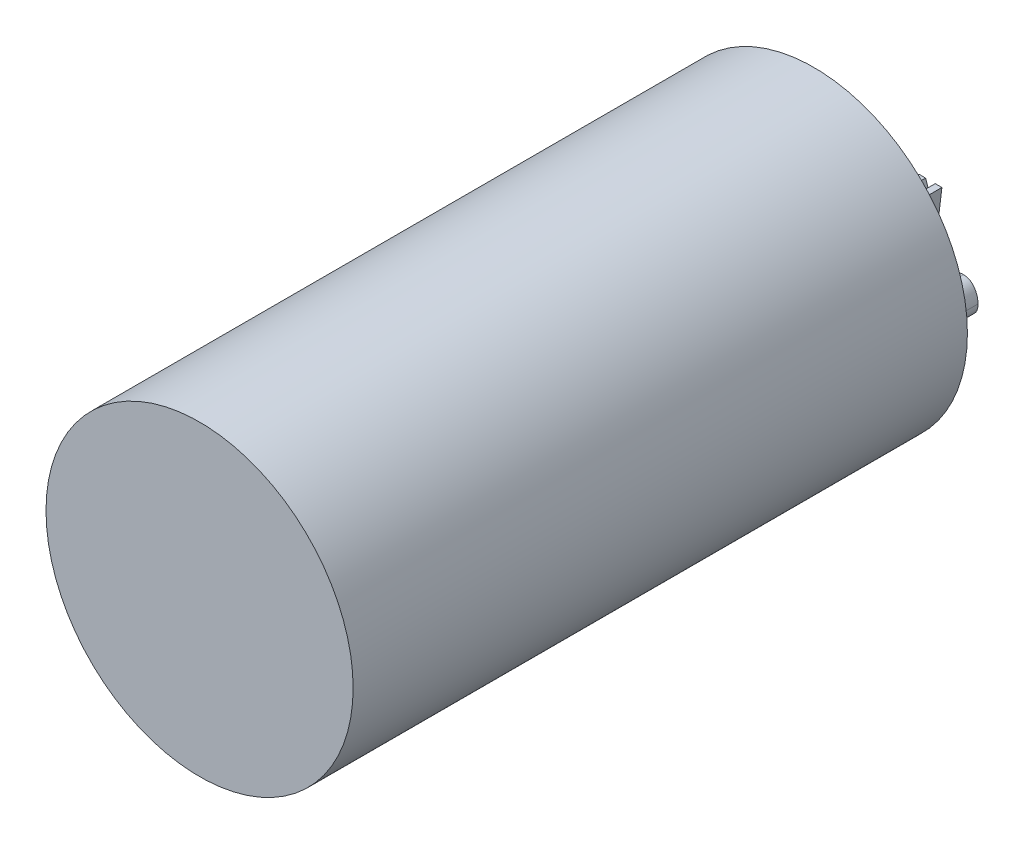
from build123d import *

# Parameters (mm, degrees)
SKETCH1_R           = 15
BOSS_EXTRUDE1_DEPTH = 60
BOSS_EXTRUDE2_DEPTH = 5


with BuildPart() as part:
    # Sketch1 → Boss-Extrude1 (new body)
    with BuildSketch(Plane.XY):
        Circle(SKETCH1_R)
    extrude(amount=BOSS_EXTRUDE1_DEPTH)

    # Sketch2 → Boss-Extrude2 (add)
    # profile 1 of 12: a face of its own
    with BuildSketch(Plane(origin=(0, 0, 0), x_dir=(-1, 0, 0), z_dir=(0, 0, -1))):
        Polygon((-4.940329736, 3.130604013), (-5.558920522, 3.130604013), (-5.787957726, 5.325173786), (-6.551203588, 3.130604013), (-7.150126359, 3.130604013), (-7.511129598, 6.094764169), (-6.857643947, 6.094764169), (-6.655888183, 3.957295084), (-5.918020404, 6.094764169), (-5.299429618, 6.094764169), (-5.07229577, 3.935723713), (-4.246873604, 6.094764169), (-3.714568302, 6.094764169), align=None)
    # profile 2 of 12: a face of its own
    with BuildSketch(Plane(origin=(0, 0, 0), x_dir=(-1, 0, 0), z_dir=(0, 0, -1))):
        Polygon((-1.562506818, 3.130604013), (-2.19188329, 3.130604013), (-1.980610744, 4.389356956), (-3.019843265, 4.389356956), (-3.229846906, 3.130604013), (-3.856685569, 3.130604013), (-3.368157461, 6.094764169), (-2.740684346, 6.094764169), (-2.937998946, 4.917221093), (-1.899400877, 4.917221093), (-1.701451826, 6.094764169), (-1.070171998, 6.094764169), align=None)
    # profile 3 of 12: a face of its own
    with BuildSketch(Plane(origin=(0, 0, 0), x_dir=(-1, 0, 0), z_dir=(0, 0, -1))):
        Polygon((1.024788798, 3.130604013), (-0.97373528, 3.130604013), (-0.485207172, 6.094764169), (1.472711972, 6.094764169), (1.3902332, 5.566900031), (0.061056076, 5.566900031), (-0.061393177, 4.876616159), (1.026057702, 4.876616159), (0.948654547, 4.348752022), (-0.143237497, 4.348752022), (-0.265052298, 3.65846815), (1.107267569, 3.65846815), align=None)
    # profile 4 of 12: a face of its own
    with BuildSketch(Plane(origin=(0, 0, 0), x_dir=(-1, 0, 0), z_dir=(0, 0, -1))):
        Polygon((3.420479883, 3.130604013), (1.421955805, 3.130604013), (1.910483913, 6.094764169), (3.868403057, 6.094764169), (3.785924286, 5.566900031), (2.456747161, 5.566900031), (2.334297908, 4.876616159), (3.421748787, 4.876616159), (3.344345632, 4.348752022), (2.252453588, 4.348752022), (2.130638787, 3.65846815), (3.502958654, 3.65846815), align=None)
    # profile 5 of 12: a face of its own
    with BuildSketch(Plane(origin=(0, 0, 0), x_dir=(-1, 0, 0), z_dir=(0, 0, -1))):
        Polygon((5.693721715, 3.130604013), (3.81764689, 3.130604013), (4.306174998, 6.094764169), (4.96600517, 6.094764169), (4.558052477, 3.65846815), (5.776834938, 3.65846815), align=None)
    # profile 6 of 12: a face of its own
    with BuildSketch(Plane(origin=(0, 0, 0), x_dir=(-1, 0, 0), z_dir=(0, 0, -1))):
        with BuildLine():
            add(Edge.make_bspline(
                [(-8.668370207, -2.36068232), (-8.685104015, -2.397670846), (-8.717829008, -2.470006398), (-8.772660903, -2.573206358), (-8.831074231, -2.669070136), (-8.8926074, -2.7583), (-8.957822294, -2.840404077), (-9.027507201, -2.914949986), (-9.100129574, -2.98269826), (-9.176218217, -3.043750386), (-9.256065109, -3.097011683), (-9.339918796, -3.142774519), (-9.426643211, -3.18245727), (-9.517515811, -3.213933297), (-9.611496979, -3.239723202), (-9.709381536, -3.257280488), (-9.810802927, -3.267423629), (-9.879516334, -3.269033886), (-9.914434108, -3.269852162)],
                knots=[0, 0, 0, 0, 1.184113035, 2.315676791, 3.406565009, 4.457358597, 5.475795876, 6.462339738, 7.431444695, 8.370873669, 9.305142804, 10.227376985, 11.155125197, 12.083919014, 13.029768265, 13.995450133, 14.981357185, 16, 16, 16, 16], degree=3))
            add(Edge.make_bspline(
                [(-9.914434108, -3.269852162), (-9.954893168, -3.269043752), (-10.034262132, -3.267457884), (-10.150191667, -3.250077831), (-10.260509751, -3.224008765), (-10.364863801, -3.186011786), (-10.463615901, -3.137940449), (-10.556276032, -3.078062593), (-10.643567883, -3.008233773), (-10.723775824, -2.927462106), (-10.797015005, -2.838159705), (-10.860434651, -2.740181823), (-10.914026007, -2.634639702), (-10.957781858, -2.521741881), (-10.99221304, -2.401367429), (-11.01577391, -2.273448044), (-11.030792971, -2.138135155), (-11.032652561, -2.045401163), (-11.033607591, -1.997775726)],
                knots=[0, 0, 0, 0, 1.017258723, 1.995567138, 2.942892392, 3.865335685, 4.783949258, 5.700603358, 6.635532549, 7.591264616, 8.55947736, 9.53656937, 10.521814236, 11.532720483, 12.578690266, 13.667217315, 14.801951772, 16, 16, 16, 16], degree=3))
            add(Edge.make_bspline(
                [(-11.033607591, -1.997775726), (-11.032366606, -1.938302796), (-11.029922726, -1.821182435), (-11.011264036, -1.648683005), (-10.980129611, -1.482635106), (-10.937150289, -1.32269735), (-10.880975787, -1.169064145), (-10.812471003, -1.021727836), (-10.731394464, -0.880909693), (-10.639410218, -0.74782038), (-10.538203919, -0.625180757), (-10.426938429, -0.518537339), (-10.308981313, -0.427704598), (-10.183977376, -0.352444669), (-10.050895324, -0.295107642), (-9.910832393, -0.25467063), (-9.763744473, -0.228918725), (-9.66308799, -0.225979674), (-9.611800462, -0.224482139)],
                knots=[0, 0, 0, 0, 1.127782033, 2.220947274, 3.286086381, 4.329118444, 5.358175498, 6.384594972, 7.406946978, 8.436097827, 9.449837571, 10.417168082, 11.352572802, 12.268126287, 13.177146287, 14.092277963, 15.027957817, 16, 16, 16, 16], degree=3))
            add(Edge.make_bspline(
                [(-9.611800462, -0.224482139), (-9.569894981, -0.225312886), (-9.48818819, -0.226932667), (-9.36901329, -0.240160423), (-9.2569077, -0.263404945), (-9.151086343, -0.293679155), (-9.052894306, -0.335148564), (-8.960762642, -0.383451561), (-8.876533141, -0.442739237), (-8.799165093, -0.50992994), (-8.728898375, -0.584998619), (-8.667529245, -0.668020579), (-8.613060932, -0.757481552), (-8.566742504, -0.853889198), (-8.529431782, -0.957578862), (-8.499685207, -1.067923269), (-8.477186726, -1.185188943), (-8.469346669, -1.266165767), (-8.465345538, -1.307491854)],
                knots=[0, 0, 0, 0, 1.138754331, 2.220329177, 3.252868393, 4.247684422, 5.206223284, 6.144788401, 7.069577846, 7.998501884, 8.925717292, 9.857996042, 10.799372818, 11.768553965, 12.759510364, 13.789903692, 14.872089252, 16, 16, 16, 16], degree=3))
            Line((-8.465345538, -1.307491854), (-9.029373445, -1.402025215))
            add(Edge.make_bspline(
                [(-9.029373445, -1.402025215), (-9.03244256, -1.375757769), (-9.038409936, -1.324685168), (-9.052322065, -1.250890963), (-9.070441098, -1.182464402), (-9.090056417, -1.118386605), (-9.115203671, -1.060098282), (-9.142863411, -1.006288431), (-9.174809014, -0.958013251), (-9.20972451, -0.914313212), (-9.248671974, -0.876220773), (-9.290818978, -0.842739041), (-9.336755001, -0.814900709), (-9.386210652, -0.791613624), (-9.43935284, -0.774244963), (-9.495829253, -0.761408906), (-9.555755665, -0.753708443), (-9.596973609, -0.752808518), (-9.618144983, -0.752346276)],
                knots=[0, 0, 0, 0, 1.294418599, 2.516777835, 3.671871658, 4.758890504, 5.793416733, 6.775154777, 7.716996038, 8.622457148, 9.50829182, 10.378192804, 11.25178243, 12.131789978, 13.04848633, 13.982786341, 14.963869091, 16, 16, 16, 16], degree=3))
            add(Edge.make_bspline(
                [(-9.618144983, -0.752346276), (-9.649363084, -0.753582613), (-9.710680201, -0.756010966), (-9.79943908, -0.778334612), (-9.88180363, -0.814945667), (-9.957602599, -0.866211331), (-10.02770695, -0.931167376), (-10.090262985, -1.011550836), (-10.146725412, -1.105739676), (-10.196090976, -1.211707502), (-10.238802836, -1.324076947), (-10.278267182, -1.437226894), (-10.310245992, -1.550062348), (-10.336994318, -1.661806202), (-10.358373896, -1.772667008), (-10.372593395, -1.882866784), (-10.381962208, -1.992327636), (-10.383275076, -2.065008941), (-10.383928653, -2.101191416)],
                knots=[0, 0, 0, 0, 0.879346562, 1.727170924, 2.563011672, 3.410101214, 4.296541346, 5.247735622, 6.272825465, 7.388203608, 8.540288875, 9.662727249, 10.767269374, 11.846637389, 12.903096889, 13.950082742, 14.979502627, 16, 16, 16, 16], degree=3))
            add(Edge.make_bspline(
                [(-10.383928653, -2.101191416), (-10.383351059, -2.12826936), (-10.382239346, -2.180387038), (-10.376294016, -2.255943884), (-10.364558827, -2.325581185), (-10.349967436, -2.390174966), (-10.329450173, -2.448440342), (-10.305434337, -2.501526553), (-10.276064607, -2.548350069), (-10.243155716, -2.590218515), (-10.205800883, -2.625134354), (-10.167862646, -2.657055281), (-10.12683802, -2.68286465), (-10.084481384, -2.704642191), (-10.039953233, -2.7212971), (-9.993845996, -2.733344695), (-9.945529445, -2.740453656), (-9.912765725, -2.741469358), (-9.896034997, -2.741988025)],
                knots=[0, 0, 0, 0, 1.429650738, 2.751688866, 3.996027973, 5.154957347, 6.242372465, 7.251313751, 8.224029905, 9.153302885, 10.053348888, 10.918157174, 11.766671565, 12.60543599, 13.428602504, 14.270703464, 15.116938183, 16, 16, 16, 16], degree=3))
            add(Edge.make_bspline(
                [(-9.896034997, -2.741988025), (-9.878466669, -2.741421594), (-9.843406509, -2.740291197), (-9.791387162, -2.733624758), (-9.740813844, -2.720342128), (-9.691354416, -2.703266438), (-9.642565595, -2.681845917), (-9.595793638, -2.653879397), (-9.549229057, -2.622595181), (-9.489617333, -2.572334741), (-9.419069235, -2.500996361), (-9.342370163, -2.40362117), (-9.274050689, -2.294010368), (-9.236861733, -2.214341917), (-9.217805715, -2.173518954)],
                knots=[0, 0, 0, 0, 0.675580204, 1.348218825, 2.010758383, 2.681822888, 3.358722633, 4.054545806, 4.773909011, 5.512986931, 7.047937461, 8.62240557, 10.269284635, 12, 12, 12, 12], degree=3))
            Line((-9.217805715, -2.173518954), (-8.668370207, -2.36068232))
        make_face()
    # profile 7 of 12: a face of its own
    with BuildSketch(Plane(origin=(0, 0, 0), x_dir=(-1, 0, 0), z_dir=(0, 0, -1))):
        Polygon((-6.60957318, -3.229247229), (-8.485648005, -3.229247229), (-7.997119897, -0.265087073), (-7.337289725, -0.265087073), (-7.745242418, -2.701383091), (-6.526459957, -2.701383091), align=None)
    # profile 8 of 12: a face of its own
    with BuildSketch(Plane(origin=(0, 0, 0), x_dir=(-1, 0, 0), z_dir=(0, 0, -1))):
        Polygon((-3.846534336, -3.229247229), (-4.53745266, -3.229247229), (-4.641502802, -2.57956829), (-5.632516964, -2.57956829), (-5.937688419, -3.229247229), (-6.526459957, -3.229247229), (-5.101480566, -0.265087073), (-4.364881692, -0.265087073), align=None)
        Polygon((-4.717637053, -2.051704153), (-4.892745829, -0.851955254), (-5.402845308, -2.051704153), align=None, mode=Mode.SUBTRACT)
    # profile 9 of 12: a face of its own
    with BuildSketch(Plane(origin=(0, 0, 0), x_dir=(-1, 0, 0), z_dir=(0, 0, -1))):
        with BuildLine():
            Line((-2.962108125, -3.229247229), (-3.613055967, -3.229247229))
            Line((-3.613055967, -3.229247229), (-3.12452786, -0.265087073))
            Line((-3.12452786, -0.265087073), (-2.309891378, -0.265087073))
            add(Edge.make_bspline(
                [(-2.309891378, -0.265087073), (-2.279225237, -0.264960496), (-2.21979326, -0.264715185), (-2.133725725, -0.266425707), (-2.053353376, -0.267421348), (-1.978906028, -0.269332162), (-1.910168127, -0.271846584), (-1.84755711, -0.274928288), (-1.790661745, -0.278800531), (-1.722532446, -0.284350357), (-1.640732721, -0.296044741), (-1.545427814, -0.32319212), (-1.451186681, -0.361749817), (-1.359457069, -0.411603271), (-1.271803077, -0.47146312), (-1.194036068, -0.544235183), (-1.125041776, -0.626691785), (-1.068227261, -0.720178484), (-1.020964262, -0.820087608), (-0.988054487, -0.926471696), (-0.966808133, -1.036997003), (-0.96466546, -1.112616719), (-0.963584047, -1.150782188)],
                knots=[0, 0, 0, 0, 0.994335949, 1.927055335, 2.791207829, 3.600653039, 4.341769672, 5.021526407, 5.633228291, 6.190755245, 7.238179215, 8.306363877, 9.39515093, 10.53351481, 11.68630751, 12.826652518, 13.975972635, 15.161545079, 16.36418918, 17.550534829, 18.763748535, 20, 20, 20, 20], degree=3))
            add(Edge.make_bspline(
                [(-0.963584047, -1.150782188), (-0.964031327, -1.176391718), (-0.964920869, -1.22732349), (-0.973273661, -1.302670692), (-0.987578074, -1.376137434), (-1.006157122, -1.447828836), (-1.031526682, -1.517343764), (-1.060916299, -1.585320671), (-1.096979067, -1.651098928), (-1.137860867, -1.714203491), (-1.181730399, -1.774306215), (-1.22895802, -1.829124192), (-1.278474919, -1.878635799), (-1.329967431, -1.923206768), (-1.383464317, -1.962944831), (-1.439428403, -1.997059785), (-1.497299793, -2.0267998), (-1.579485442, -2.057952093), (-1.689202204, -2.088740517), (-1.830681724, -2.114370971), (-1.984047109, -2.130415091), (-2.090540768, -2.132062677), (-2.145568287, -2.13291402)],
                knots=[0, 0, 0, 0, 0.882260718, 1.754624234, 2.607876179, 3.45988241, 4.303526378, 5.155189717, 6.009561253, 6.884841974, 7.744789598, 8.571583785, 9.375450413, 10.155613962, 10.916443995, 11.668851297, 12.411919061, 13.154879613, 14.693425068, 16.331427967, 18.104371485, 20, 20, 20, 20], degree=3))
            Line((-2.145568287, -2.13291402), (-2.778751471, -2.13291402))
            Line((-2.778751471, -2.13291402), (-2.962108125, -3.229247229))
        make_face()
        with BuildLine():
            Line((-2.554155432, -0.79295121), (-2.696907152, -1.605049883))
            Line((-2.696907152, -1.605049883), (-2.247715074, -1.605049883))
            add(Edge.make_bspline(
                [(-2.247715074, -1.605049883), (-2.225720373, -1.604877284), (-2.183630835, -1.604546996), (-2.123340247, -1.603461853), (-2.068324375, -1.601001752), (-2.018641404, -1.597049829), (-1.974133474, -1.593009575), (-1.935252914, -1.587059704), (-1.901460831, -1.581073176), (-1.863376074, -1.571018323), (-1.819945603, -1.553296348), (-1.773354313, -1.520892022), (-1.729040563, -1.480805794), (-1.689704685, -1.431132989), (-1.654817301, -1.374724683), (-1.631109226, -1.310206754), (-1.615999706, -1.240092822), (-1.614195737, -1.191258896), (-1.613262985, -1.166009038)],
                knots=[0, 0, 0, 0, 1.182964183, 2.263745945, 3.242978596, 4.144122699, 4.944282828, 5.645615768, 6.259081123, 6.788803058, 7.76260395, 8.762622204, 9.825357984, 10.965781127, 12.159577196, 13.376343307, 14.64342341, 16, 16, 16, 16], degree=3))
            add(Edge.make_bspline(
                [(-1.613262985, -1.166009038), (-1.614107992, -1.143321252), (-1.615733477, -1.099678194), (-1.628303471, -1.037417079), (-1.65006717, -0.981795455), (-1.680226852, -0.933576397), (-1.715574679, -0.892298652), (-1.75532222, -0.858604592), (-1.799004539, -0.833609935), (-1.838819038, -0.819229727), (-1.874387189, -0.812331647), (-1.906155631, -0.805943484), (-1.94361558, -0.803163104), (-1.986239994, -0.798633107), (-2.034337238, -0.796901181), (-2.087792668, -0.793543944), (-2.146631517, -0.793742943), (-2.187655657, -0.793222277), (-2.209013496, -0.79295121)],
                knots=[0, 0, 0, 0, 1.33489118, 2.567845761, 3.719092883, 4.831521549, 5.899599919, 6.906969996, 7.882848283, 8.847545925, 9.382273889, 10.014727554, 10.753007201, 11.590428501, 12.537862549, 13.584764086, 14.742588665, 16, 16, 16, 16], degree=3))
            Line((-2.209013496, -0.79295121), (-2.554155432, -0.79295121))
        make_face(mode=Mode.SUBTRACT)
    # profile 10 of 12: a face of its own
    with BuildSketch(Plane(origin=(0, 0, 0), x_dir=(-1, 0, 0), z_dir=(0, 0, -1))):
        with BuildLine():
            Line((2.56904518, -3.229247229), (1.906042748, -3.229247229))
            Line((1.906042748, -3.229247229), (1.559631908, -2.092309087))
            Line((1.559631908, -2.092309087), (0.981646056, -2.092309087))
            Line((0.981646056, -2.092309087), (0.791310429, -3.229247229))
            Line((0.791310429, -3.229247229), (0.161933958, -3.229247229))
            Line((0.161933958, -3.229247229), (0.650462066, -0.265087073))
            Line((0.650462066, -0.265087073), (1.788669112, -0.265087073))
            add(Edge.make_bspline(
                [(1.788669112, -0.265087073), (1.817011105, -0.265362643), (1.872232357, -0.265899561), (1.952835878, -0.269135619), (2.029448679, -0.274075741), (2.101885059, -0.281367542), (2.170298667, -0.292099419), (2.234821335, -0.302897117), (2.295213015, -0.3168534), (2.351773313, -0.333575935), (2.405844883, -0.352954736), (2.457325254, -0.378259191), (2.50772246, -0.40721319), (2.555862115, -0.441768972), (2.602518429, -0.48078039), (2.64761348, -0.524559659), (2.690591333, -0.57356853), (2.731513337, -0.626513049), (2.76956933, -0.682367818), (2.80228864, -0.741000941), (2.831280239, -0.800444219), (2.854133598, -0.861911745), (2.871907061, -0.924728745), (2.884622497, -0.989220098), (2.892440049, -1.055209221), (2.89340101, -1.099793281), (2.89388465, -1.122231844)],
                knots=[0, 0, 0, 0, 1.285733318, 2.505109678, 3.658939975, 4.768235328, 5.806202076, 6.799906251, 7.735452271, 8.615799046, 9.474819834, 10.337315964, 11.214363096, 12.108816232, 13.021503561, 13.971353679, 14.956919652, 15.975913429, 17.005689557, 18.019566939, 19.019411846, 20.00306142, 20.990120534, 21.977925373, 22.982316827, 24, 24, 24, 24], degree=3))
            add(Edge.make_bspline(
                [(2.89388465, -1.122231844), (2.893510398, -1.1463718), (2.89276257, -1.194608075), (2.883160992, -1.266445886), (2.869325023, -1.337458292), (2.850544996, -1.407703542), (2.824562172, -1.476610046), (2.793592189, -1.544840387), (2.757374807, -1.61240307), (2.715632969, -1.677922256), (2.66955534, -1.740754693), (2.616750371, -1.797213184), (2.560515161, -1.849194786), (2.49831983, -1.894271116), (2.431724336, -1.933826667), (2.359822492, -1.966612521), (2.283900571, -1.995103933), (2.230618087, -2.00824344), (2.203600778, -2.014905932)],
                knots=[0, 0, 0, 0, 0.948974451, 1.896233479, 2.845791196, 3.794327961, 4.752447616, 5.739073173, 6.740321359, 7.765038285, 8.793294947, 9.800057795, 10.801202292, 11.801240092, 12.815673103, 13.842953343, 14.90625222, 16, 16, 16, 16], degree=3))
            Line((2.203600778, -2.014905932), (2.56904518, -3.229247229))
        make_face()
        with BuildLine():
            Line((1.062855923, -1.564444949), (1.725223903, -1.564444949))
            add(Edge.make_bspline(
                [(1.725223903, -1.564444949), (1.75083025, -1.564174995), (1.800014604, -1.563656469), (1.870149104, -1.557139671), (1.933502945, -1.547476522), (1.989566214, -1.532852295), (2.039175204, -1.514642529), (2.081789146, -1.491987855), (2.117866491, -1.465184079), (2.15420058, -1.423273244), (2.189204261, -1.367197891), (2.221045433, -1.297789078), (2.240453808, -1.22583994), (2.242952514, -1.177120313), (2.244205711, -1.152685544)],
                knots=[0, 0, 0, 0, 1.217750813, 2.339040677, 3.348000426, 4.263105847, 5.090922102, 5.856150885, 6.552395797, 7.214969701, 8.482012273, 9.684371194, 10.83862299, 12, 12, 12, 12], degree=3))
            add(Edge.make_bspline(
                [(2.244205711, -1.152685544), (2.243365803, -1.132730155), (2.24173046, -1.093876002), (2.228605124, -1.037971171), (2.207747474, -0.98617703), (2.177467502, -0.940365606), (2.142431232, -0.899749563), (2.102537877, -0.866557786), (2.05966258, -0.839731433), (2.011126252, -0.821115762), (1.954886484, -0.807466695), (1.887397478, -0.799666792), (1.807174433, -0.793727), (1.74934843, -0.793222546), (1.71824493, -0.79295121)],
                knots=[0, 0, 0, 0, 0.985489964, 1.918798856, 2.82356305, 3.731282323, 4.620386599, 5.466401135, 6.287633529, 7.108865923, 8.024259577, 9.142112323, 10.462796919, 12, 12, 12, 12], degree=3))
            Line((1.71824493, -0.79295121), (1.199263122, -0.79295121))
            Line((1.199263122, -0.79295121), (1.062855923, -1.564444949))
        make_face(mode=Mode.SUBTRACT)
    # profile 11 of 12: a face of its own
    with BuildSketch(Plane(origin=(0, 0, 0), x_dir=(-1, 0, 0), z_dir=(0, 0, -1))):
        with BuildLine():
            add(Edge.make_bspline(
                [(3.096909318, -1.957805244), (3.098216312, -1.90340936), (3.100801682, -1.795808609), (3.118792341, -1.636184478), (3.149464887, -1.480811009), (3.191270929, -1.328725345), (3.246133452, -1.18072482), (3.312915132, -1.036566473), (3.391462669, -0.896072889), (3.466447097, -0.78335602), (3.531718323, -0.696646114), (3.583174926, -0.635634835), (3.636718114, -0.578820756), (3.692409916, -0.52625373), (3.750211425, -0.477888452), (3.810233224, -0.433895677), (3.872222849, -0.393891388), (3.936612376, -0.358423703), (4.002547883, -0.326502603), (4.070597831, -0.299167794), (4.140826192, -0.276370044), (4.212998135, -0.25720394), (4.287654639, -0.242779018), (4.364075793, -0.231962613), (4.442677766, -0.225397738), (4.495652113, -0.224790273), (4.52252316, -0.224482139)],
                knots=[0, 0, 0, 0, 1.568399033, 3.102457404, 4.624896766, 6.131017688, 7.645571501, 9.170756296, 10.707781305, 12.282391937, 13.070275646, 13.836237491, 14.582527005, 15.320196136, 16.043201046, 16.754277787, 17.464726691, 18.16897206, 18.872662769, 19.575877709, 20.281679073, 21.000531638, 21.727665181, 22.472782792, 23.225324574, 24, 24, 24, 24], degree=3))
            add(Edge.make_bspline(
                [(4.52252316, -0.224482139), (4.569093113, -0.225597461), (4.659788543, -0.227769561), (4.792085941, -0.244106604), (4.91596198, -0.273026706), (5.032747946, -0.311270282), (5.14090256, -0.362458349), (5.241490832, -0.42440496), (5.33407867, -0.497725004), (5.417505704, -0.58242306), (5.492458748, -0.675817256), (5.557984174, -0.776975953), (5.613538306, -0.8855729), (5.658610942, -1.001679857), (5.693448487, -1.125146779), (5.717806268, -1.255970097), (5.733522526, -1.393818135), (5.735314378, -1.488266484), (5.736230005, -1.536529057)],
                knots=[0, 0, 0, 0, 1.105469446, 2.152912326, 3.157672053, 4.121390649, 5.064687342, 5.991240903, 6.920402489, 7.86119733, 8.807602049, 9.758749149, 10.717537804, 11.698367469, 12.710762457, 13.758457992, 14.854584695, 16, 16, 16, 16], degree=3))
            add(Edge.make_bspline(
                [(5.736230005, -1.536529057), (5.734986989, -1.591355244), (5.732527478, -1.699837914), (5.713616935, -1.860471958), (5.682795784, -2.016943526), (5.638358388, -2.169293673), (5.583006803, -2.317957836), (5.513654117, -2.461881199), (5.432899496, -2.602027566), (5.355708642, -2.714223777), (5.288772286, -2.800498105), (5.235099738, -2.860619415), (5.180155505, -2.917511446), (5.122061778, -2.969316078), (5.062569585, -3.017988199), (4.999974745, -3.061644326), (4.935698135, -3.101889918), (4.86838223, -3.136383466), (4.79982587, -3.168827521), (4.728206086, -3.195715913), (4.654507155, -3.218701005), (4.578581316, -3.237012925), (4.500433073, -3.251592086), (4.419987466, -3.262400523), (4.337161305, -3.268930177), (4.281231766, -3.269542019), (4.252881023, -3.269852162)],
                knots=[0, 0, 0, 0, 1.551020905, 3.068951176, 4.569943332, 6.058538449, 7.554548213, 9.053427563, 10.573526611, 12.12713113, 12.902843569, 13.661684844, 14.406451335, 15.139465588, 15.862816863, 16.580028346, 17.297439512, 18.006743794, 18.718919867, 19.442419638, 20.169227926, 20.902168898, 21.650963257, 22.417714599, 23.197937835, 24, 24, 24, 24], degree=3))
            add(Edge.make_bspline(
                [(4.252881023, -3.269852162), (4.213478907, -3.268792748), (4.135564183, -3.266697834), (4.021232718, -3.248919761), (3.911174651, -3.221218811), (3.805898172, -3.181514363), (3.705127281, -3.130683251), (3.609577428, -3.067556627), (3.517784437, -2.994586651), (3.431947831, -2.910371871), (3.353590915, -2.81698052), (3.284629824, -2.715431742), (3.225912333, -2.606767541), (3.179126702, -2.490357692), (3.142261162, -2.367381624), (3.115648998, -2.237268767), (3.099537, -2.099907503), (3.097797859, -2.005856599), (3.096909318, -1.957805244)],
                knots=[0, 0, 0, 0, 0.966377969, 1.91093987, 2.83227868, 3.747002311, 4.66605833, 5.595893213, 6.552242406, 7.539409226, 8.541401131, 9.538880902, 10.546568082, 11.566144809, 12.611969273, 13.69283323, 14.821250146, 16, 16, 16, 16], degree=3))
        make_face()
        with BuildLine():
            add(Edge.make_bspline(
                [(3.746588256, -2.039649563), (3.747005185, -2.071603863), (3.747804452, -2.132861352), (3.755785467, -2.220962233), (3.767185601, -2.301456447), (3.784427445, -2.374481111), (3.806116027, -2.440006827), (3.83366699, -2.497589117), (3.865241676, -2.547989462), (3.902610924, -2.590016896), (3.943141517, -2.625483322), (3.98479189, -2.656739724), (4.028436205, -2.682929786), (4.073527554, -2.704825299), (4.120705612, -2.721062757), (4.169035569, -2.733385889), (4.219049984, -2.740408697), (4.252860114, -2.741456499), (4.270011229, -2.741988025)],
                knots=[0, 0, 0, 0, 1.543872971, 2.959657453, 4.27213723, 5.469535067, 6.581389867, 7.600854134, 8.54780435, 9.445834552, 10.307352509, 11.147507192, 11.959075049, 12.763662104, 13.56532255, 14.366005083, 15.17111131, 16, 16, 16, 16], degree=3))
            add(Edge.make_bspline(
                [(4.270011229, -2.741988025), (4.303754481, -2.740963801), (4.369568967, -2.738966105), (4.464450506, -2.717709642), (4.552767312, -2.684680336), (4.634208154, -2.637762339), (4.708591879, -2.577254564), (4.775511347, -2.503070425), (4.836120191, -2.416148971), (4.887748993, -2.317021676), (4.933824971, -2.21171977), (4.974348712, -2.103595611), (5.009754572, -1.994563632), (5.037193933, -1.883754668), (5.059944744, -1.772305922), (5.074690091, -1.659279122), (5.08477582, -1.545383301), (5.085958832, -1.468876191), (5.086551066, -1.430575559)],
                knots=[0, 0, 0, 0, 0.944861373, 1.842903722, 2.711984396, 3.580761468, 4.46626082, 5.389830362, 6.373718752, 7.429752043, 8.518503329, 9.595822474, 10.666805212, 11.731248618, 12.79551026, 13.854869125, 14.926114576, 16, 16, 16, 16], degree=3))
            add(Edge.make_bspline(
                [(5.086551066, -1.430575559), (5.085932251, -1.403290876), (5.084726519, -1.350127975), (5.079220784, -1.273002749), (5.066345334, -1.201350192), (5.05137325, -1.134602121), (5.029998979, -1.07369077), (5.00549313, -1.017297449), (4.974831403, -0.967030357), (4.94070359, -0.920988826), (4.900535859, -0.88190822), (4.857398254, -0.845974518), (4.80825971, -0.817281858), (4.754860678, -0.793435265), (4.697098178, -0.775331933), (4.634685685, -0.761927655), (4.567796401, -0.753568598), (4.521490655, -0.752760214), (4.497779529, -0.752346276)],
                knots=[0, 0, 0, 0, 1.273359639, 2.481080504, 3.601889716, 4.666806446, 5.668365786, 6.609030014, 7.529505291, 8.409595858, 9.274682039, 10.137571208, 11.02251505, 11.919097279, 12.861415787, 13.840614429, 14.894274038, 16, 16, 16, 16], degree=3))
            add(Edge.make_bspline(
                [(4.497779529, -0.752346276), (4.468676579, -0.753653271), (4.41163562, -0.756214945), (4.328849596, -0.777540631), (4.251196703, -0.811426071), (4.178463126, -0.859229462), (4.111417894, -0.921395347), (4.049390094, -0.99663134), (3.992671135, -1.085491752), (3.94233635, -1.185546968), (3.896967931, -1.291812839), (3.857198477, -1.399736245), (3.82229469, -1.50700398), (3.795411533, -1.61441248), (3.773749381, -1.721101075), (3.757442815, -1.827323652), (3.748648216, -1.933544679), (3.74727421, -2.004317287), (3.746588256, -2.039649563)],
                knots=[0, 0, 0, 0, 0.855913069, 1.677565449, 2.500208426, 3.341381984, 4.2273737, 5.182599809, 6.205218887, 7.324853273, 8.477007942, 9.606041692, 10.710909566, 11.79688972, 12.864320138, 13.915901188, 14.959541612, 16, 16, 16, 16], degree=3))
        make_face(mode=Mode.SUBTRACT)
    # profile 12 of 12: a face of its own
    with BuildSketch(Plane(origin=(0, 0, 0), x_dir=(-1, 0, 0), z_dir=(0, 0, -1))):
        with BuildLine():
            Line((5.888498506, -3.229247229), (6.377026614, -0.265087073))
            Line((6.377026614, -0.265087073), (7.260183921, -0.265087073))
            add(Edge.make_bspline(
                [(7.260183921, -0.265087073), (7.309477068, -0.265823573), (7.403749688, -0.267232121), (7.5381891, -0.277592845), (7.658624583, -0.295885569), (7.767405653, -0.320856321), (7.86788738, -0.357570812), (7.964226909, -0.405836205), (8.057155861, -0.468585729), (8.147761964, -0.542319757), (8.233482962, -0.629251733), (8.309313826, -0.731090261), (8.377216689, -0.845504455), (8.434078116, -0.972978204), (8.48158453, -1.110930981), (8.513751815, -1.25936812), (8.534933244, -1.416426631), (8.536942117, -1.524401331), (8.537970426, -1.579671799)],
                knots=[0, 0, 0, 0, 1.130278467, 2.161645588, 3.088903523, 3.921655378, 4.716301751, 5.536075305, 6.386099979, 7.282092992, 8.21141557, 9.177415045, 10.186236152, 11.256201696, 12.37261119, 13.525579568, 14.733385, 16, 16, 16, 16], degree=3))
            add(Edge.make_bspline(
                [(8.537970426, -1.579671799), (8.537428671, -1.613097044), (8.536350862, -1.679595774), (8.529361759, -1.778509613), (8.517260714, -1.876136154), (8.500059817, -1.972223026), (8.478513825, -2.06736098), (8.451816019, -2.160893468), (8.420752759, -2.253313658), (8.384723608, -2.3434374), (8.344903857, -2.430238562), (8.303030653, -2.513133083), (8.25889223, -2.590920621), (8.21221759, -2.663706331), (8.163820295, -2.731705213), (8.111871083, -2.79385933), (8.058858929, -2.85204507), (7.98547686, -2.920623554), (7.892393013, -2.995366251), (7.779128378, -3.070739764), (7.665716819, -3.128482937), (7.569261532, -3.163209816), (7.489738674, -3.18243352), (7.425587805, -3.195028204), (7.356007073, -3.206077644), (7.280765214, -3.213697056), (7.200211005, -3.220887246), (7.114320675, -3.226059813), (7.022909414, -3.228209002), (6.960088569, -3.228894266), (6.927731027, -3.229247229)],
                knots=[0, 0, 0, 0, 1.07062819, 2.129989358, 3.174365755, 4.220125244, 5.255388947, 6.297522161, 7.334313897, 8.377107372, 9.404719156, 10.392324038, 11.351000558, 12.26799024, 13.160971519, 14.022223654, 14.861128429, 15.680553304, 17.236751141, 18.679667659, 20.030796239, 21.30347122, 21.952429061, 22.649883551, 23.397171101, 24.208067837, 25.071581354, 25.987669867, 26.963495982, 28, 28, 28, 28], degree=3))
            Line((6.927731027, -3.229247229), (5.888498506, -3.229247229))
        make_face()
        with BuildLine():
            Line((6.607967174, -2.701383091), (6.9956174, -2.701383091))
            add(Edge.make_bspline(
                [(6.9956174, -2.701383091), (7.031377994, -2.700597409), (7.099249001, -2.69910624), (7.19535104, -2.689570846), (7.279819667, -2.671974605), (7.354775336, -2.647074136), (7.422449743, -2.611795887), (7.487937958, -2.568434755), (7.550930018, -2.513704463), (7.614266969, -2.450106467), (7.673879017, -2.37251799), (7.726942086, -2.278911592), (7.773445816, -2.169500563), (7.813721179, -2.046728184), (7.846675027, -1.915034039), (7.871003603, -1.778980583), (7.885051061, -1.640875569), (7.88720801, -1.548191304), (7.888291488, -1.501634193)],
                knots=[0, 0, 0, 0, 1.011863417, 1.920443174, 2.727850673, 3.448792289, 4.147233589, 4.880754079, 5.66606434, 6.503852086, 7.41701108, 8.424885986, 9.539777864, 10.775370603, 12.077127565, 13.377646265, 14.682740666, 16, 16, 16, 16], degree=3))
            add(Edge.make_bspline(
                [(7.888291488, -1.501634193), (7.88722343, -1.466067992), (7.885136055, -1.396558696), (7.871546067, -1.294897134), (7.846275233, -1.199397671), (7.813207118, -1.110195543), (7.771608647, -1.029149105), (7.719141971, -0.960460387), (7.657741772, -0.904244208), (7.585829296, -0.861657514), (7.502774266, -0.830677111), (7.407375665, -0.807965856), (7.297958289, -0.795232237), (7.220457941, -0.793738526), (7.179608506, -0.79295121)],
                knots=[0, 0, 0, 0, 1.105931688, 2.161392842, 3.180506734, 4.170983809, 5.115154355, 6.001576288, 6.84418701, 7.687695231, 8.582781489, 9.590718491, 10.730098744, 12, 12, 12, 12], degree=3))
            Line((7.179608506, -0.79295121), (6.934075547, -0.79295121))
            Line((6.934075547, -0.79295121), (6.607967174, -2.701383091))
        make_face(mode=Mode.SUBTRACT)
    extrude(amount=BOSS_EXTRUDE2_DEPTH)


solid = part.part
